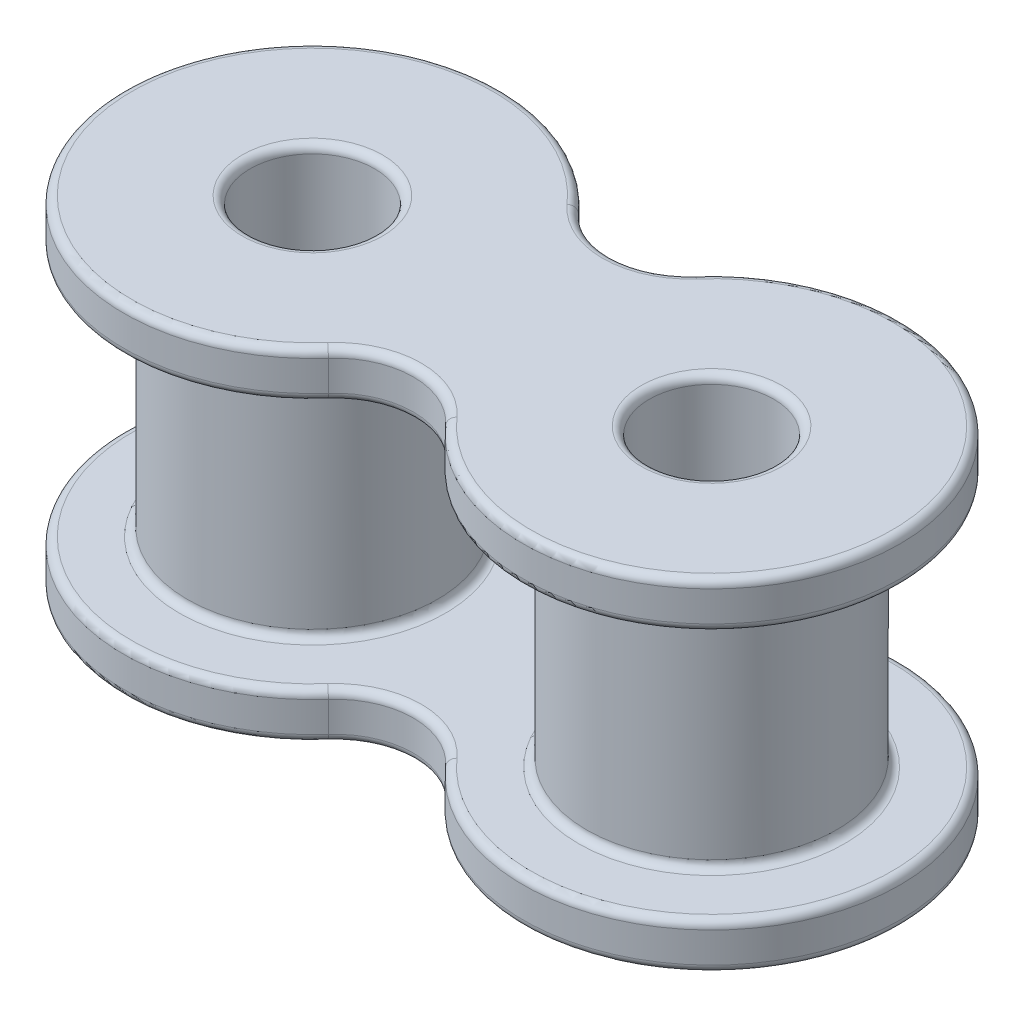
from build123d import *

# Parameters (mm, degrees)
SKETCH1_R             = 1.9812
BOSS_EXTRUDE1_DEPTH   = 0.7366
SKETCH5_R             = 3.9751
SKETCH5_R_2           = 1.9812
BOSS_EXTRUDE2_DEPTH   = 7.9248
FILLET_2_R            = 0.254
FILLET_2_OF_MIRROR2_R = 0.254


with BuildPart() as part:
    # Sketch1 → Boss-Extrude1 (new, symmetric)
    with BuildSketch(Plane(origin=(0, 0, 0), x_dir=(1, 0, 0), z_dir=(0, 1, 0))):
        with BuildLine():
            ThreePointArc((-1.865444619, 3.977636785), (-12.3444, 0), (-1.865444619, -3.977636785))
            ThreePointArc((-1.865444619, -3.977636785), (0, -3.138721939), (1.865444619, -3.977636785))
            ThreePointArc((1.865444619, -3.977636785), (12.3444, 0), (1.865444619, 3.977636785))
            ThreePointArc((1.865444619, 3.977636785), (0, 3.138721939), (-1.865444619, 3.977636785))
        make_face()
        with Locations(Location((-6.35, 0, 0), (0, 0, 270))):
            Circle(SKETCH1_R, mode=Mode.SUBTRACT)
        with Locations(Location((6.35, 0, 0), (0, 0, 90))):
            Circle(SKETCH1_R, mode=Mode.SUBTRACT)
    boss_extrude1 = extrude(amount=BOSS_EXTRUDE1_DEPTH, both=True)

    # Sketch5 → Boss-Extrude2 (add)
    # profile 1 of 2: a face of its own
    with BuildSketch(Plane(origin=(0, 0.7366, 0), x_dir=(1, 0, 0), z_dir=(0, 1, 0))):
        with Locations(Location((6.35, 0, 0), (0, 0, 270))):
            Circle(SKETCH5_R)
        with Locations(Location((6.35, 0, 0), (0, 0, 90))):
            Circle(SKETCH5_R_2, mode=Mode.SUBTRACT)
    # profile 2 of 2: a face of its own
    with BuildSketch(Plane(origin=(0, 0.7366, 0), x_dir=(1, 0, 0), z_dir=(0, 1, 0))):
        with Locations(Location((-6.35, 0, 0), (0, 0, 90))):
            Circle(SKETCH5_R)
        with Locations(Location((-6.35, 0, 0), (0, 0, 90))):
            Circle(SKETCH5_R_2, mode=Mode.SUBTRACT)
    extrude(amount=BOSS_EXTRUDE2_DEPTH)

    # Fillet 2
    fillet_2_edges = [part.edges().sort_by_distance(p)[0] for p in [
        (-6.35, -0.7366, -1.9812),
        (0, 0.7366, 3.138721939),
        (6.35, -0.7366, 1.9812),
        (12.3444, 0.7366, 0),
        (6.35, 0.7366, -3.9751),
        (-6.35, 0.7366, 3.9751),
        (0, 0.7366, -3.138721939),
        (12.3444, -0.7366, 0),
        (0, -0.7366, 3.138721939),
        (-12.3444, -0.7366, 0),
        (0, -0.7366, -3.138721939),
        (-12.3444, 0.7366, 0),
    ]]
    fillet(fillet_2_edges, radius=FILLET_2_R)

    # Mirror2: Boss-Extrude1 across plane
    add(boss_extrude1.mirror(Plane.ZX.offset(4.699)))

    # Fillet 2 of Mirror2
    fillet_2_of_mirror2_edges = [part.edges().sort_by_distance(p)[0] for p in [
        (-6.35, 10.1346, -1.9812),
        (0, 8.6614, 3.138721939),
        (6.35, 10.1346, 1.9812),
        (12.3444, 8.6614, 0),
        (6.35, 8.6614, -3.9751),
        (-6.35, 8.6614, 3.9751),
        (0, 8.6614, -3.138721939),
        (12.3444, 10.1346, 0),
        (0, 10.1346, 3.138721939),
        (-12.3444, 10.1346, 0),
        (0, 10.1346, -3.138721939),
        (-12.3444, 8.6614, 0),
    ]]
    fillet(fillet_2_of_mirror2_edges, radius=FILLET_2_OF_MIRROR2_R)


solid = part.part
